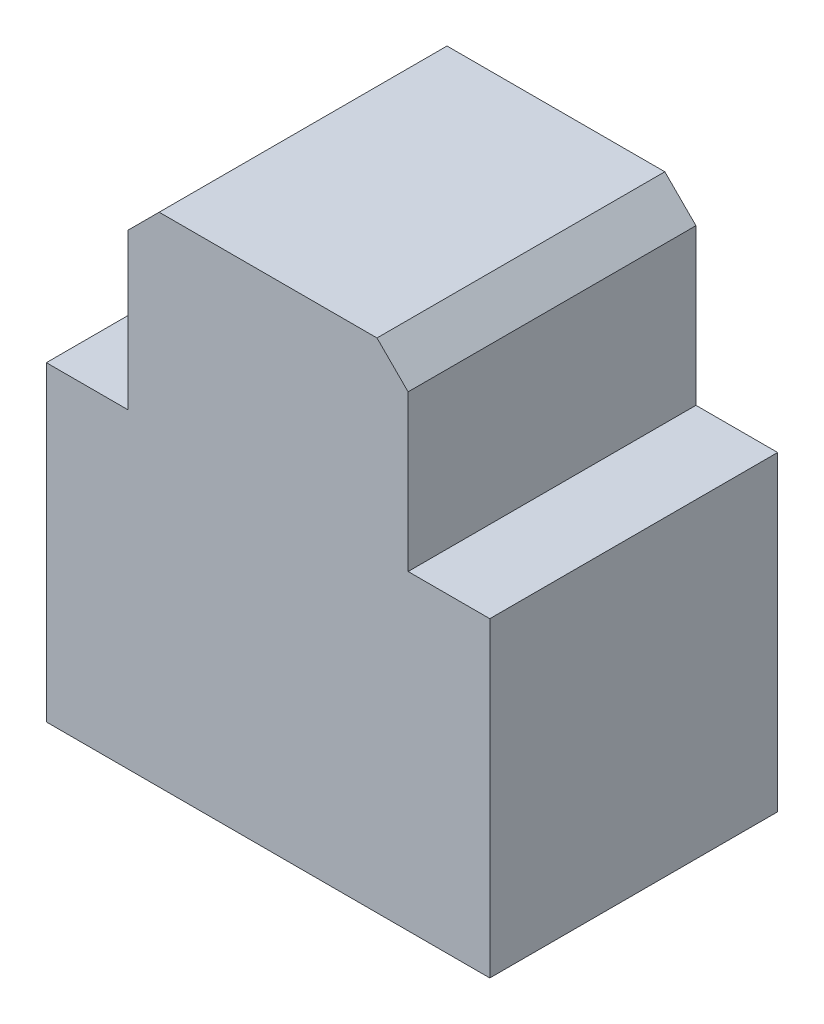
from build123d import *

# Parameters (mm, degrees)
SKETCH1_W           = 5.7
SKETCH1_H           = 4
SKETCH1_W_2         = 3.6
SKETCH1_H_2         = 2.4
BOSS_EXTRUDE1_DEPTH = 3.7
CHAMFER1_SIZE       = 0.4


with BuildPart() as part:
    # Sketch1 → Boss-Extrude1 (new body)
    with BuildSketch(Plane.XY):
        Rectangle(SKETCH1_W, SKETCH1_H)
        with Locations((0, 3.2)):
            Rectangle(SKETCH1_W_2, SKETCH1_H_2)
    extrude(amount=BOSS_EXTRUDE1_DEPTH)

    # Chamfer1
    chamfer1_edges = [part.edges().sort_by_distance(p)[0] for p in [
        (-1.8, 4.4, 1.85),
        (1.8, 4.4, 1.85),
    ]]
    chamfer(chamfer1_edges, length=CHAMFER1_SIZE)


solid = part.part
